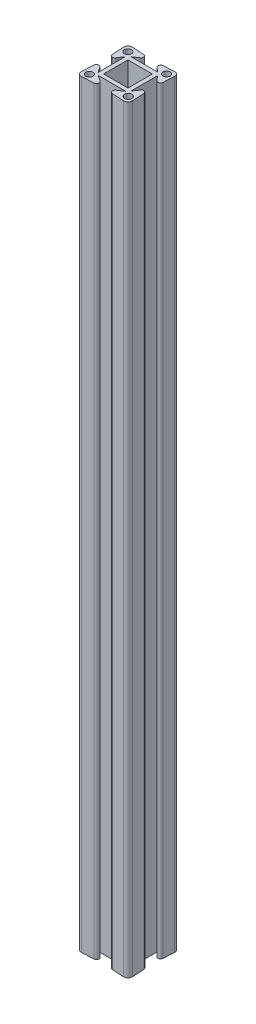
from build123d import *

# Parameters (mm, degrees)
BOSS_EXTRUDE1_DEPTH = 375
FILLET1_R           = 2.032
FILLET2_R           = 1.27
SKETCH5_W           = 12.048677603
SKETCH5_H           = 11.996966541
SKETCH5_R           = 1.809887194
SKETCH5_R_2         = 1.778
SKETCH5_R_3         = 1.784780941
CUT_EXTRUDE3_DEPTH  = 376.626052464
SCALE1_SCALE        = 0.8


with BuildPart() as part:
    # Sketch2 → Boss-Extrude1 (new body)
    with BuildSketch(Plane(origin=(0, 0, 0), x_dir=(1, 0, 0), z_dir=(0, 1, 0))):
        Polygon((-11.631944508, 4.856112595), (-11.631944508, -8.62647921), (-15.607851567, -2.645315933), (-16.258611825, -14.593573265), (-4.310354494, -13.942813006), (-10.340832945, -9.861953178), (3.339587632, -9.861953178), (-2.854456203, -13.936328227), (9.141388175, -14.593573265), (8.484143137, -2.597728887), (4.461618468, -8.47589662), (4.461618468, 4.675168062), (8.490627916, 0), (9.141388175, 10.806426735), (-1.66503856, 10.155666477), (3.011955341, 6.231609797), (-10.257604353, 6.231609797), (-4.292081103, 10.155666477), (-16.258611825, 10.806426735), (-15.607851567, -1.160103987), align=None)
    extrude(amount=BOSS_EXTRUDE1_DEPTH)

    # Fillet1
    fillet1_edges = [part.edges().sort_by_distance(p)[0] for p in [
        (9.141388175, 187.5, 14.593573265),
        (-16.258611825, 187.5, 14.593573265),
        (-16.258611825, 187.5, -10.806426735),
        (9.141388175, 187.5, -10.806426735),
    ]]
    fillet(fillet1_edges, radius=FILLET1_R)

    # Fillet2
    fillet2_edges = [part.edges().sort_by_distance(p)[0] for p in [
        (8.490627916, 187.5, 0),
        (8.484143137, 187.5, 2.597728887),
        (-2.854456203, 187.5, 13.936328227),
        (-4.310354494, 187.5, 13.942813006),
        (-15.607851567, 187.5, 2.645315933),
        (-15.607851567, 187.5, 1.160103987),
        (-4.292081103, 187.5, -10.155666477),
        (-1.66503856, 187.5, -10.155666477),
    ]]
    fillet(fillet2_edges, radius=FILLET2_R)

    # Sketch5 → Cut-Extrude3 (cut, through all)
    with BuildSketch(Plane(origin=(0, 375, 0), x_dir=(1, 0, 0), z_dir=(0, 1, 0))):
        with Locations((-3.593458736, -1.901154881)):
            Rectangle(SKETCH5_W, SKETCH5_H)
        with Locations(Location((6.050654454, -11.415990413, 0), (0, 0, 270))):
            Circle(SKETCH5_R)
        with Locations(Location((-13.030727673, -11.545268069, 0), (0, 0, 270))):
            Circle(SKETCH5_R_2)
        with Locations(Location((-13.108294267, 7.613680652, 0), (0, 0, 270))):
            Circle(SKETCH5_R_2)
        with Locations(Location((5.921376797, 7.665391714, 0), (0, 0, 270))):
            Circle(SKETCH5_R_3)
    extrude(amount=-CUT_EXTRUDE3_DEPTH, mode=Mode.SUBTRACT)


with BuildPart() as part_1:
    # Scale1: scaled about (-3.644090286, 187.5, 1.930683285)
    add(part.part.scale(SCALE1_SCALE).moved(Location((-0.728818057, 37.5, 0.386136657))))


solid = part_1.part
